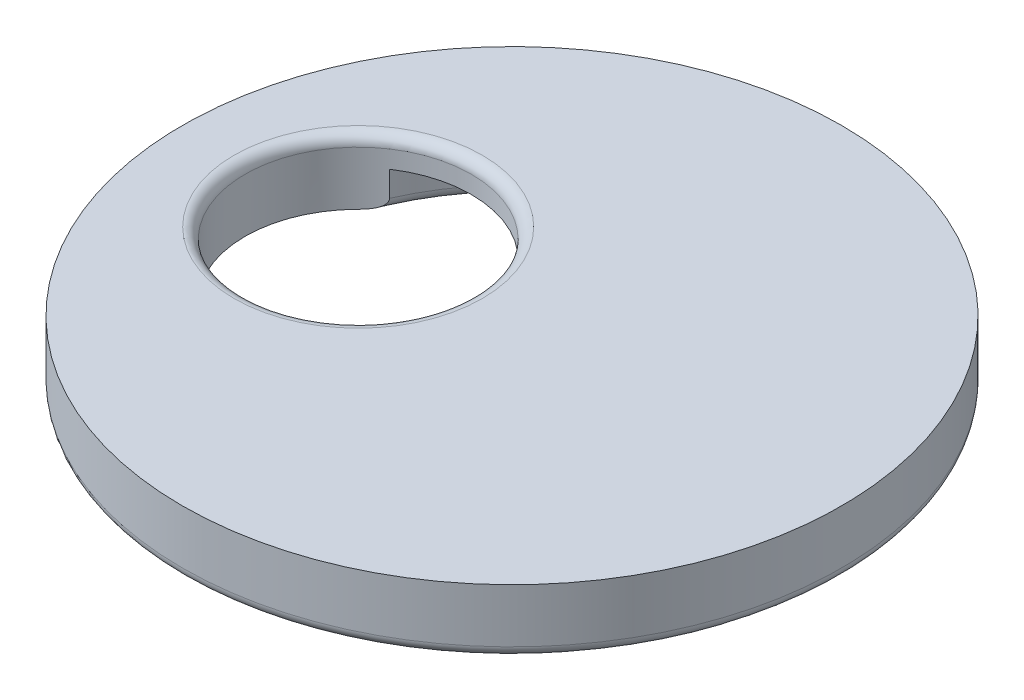
from build123d import *

# Parameters (mm, degrees)
SKETCH1_R           = 15
SKETCH1_R_2         = 5.15
BOSS_EXTRUDE1_DEPTH = 1.3
BOSS_EXTRUDE2_START = -1.65
SKETCH1_3_R         = 15
SKETCH1_3_R_2       = 10.75
BOSS_EXTRUDE2_DEPTH = 1.65
CUT_EXTRUDE1_START  = -1.65
CUT_EXTRUDE1_DEPTH  = 1.65
FILLET5_R           = 0.5
FILLET6_R           = 0.5


with BuildPart() as part:
    # Sketch1 → Boss-Extrude1 (new body)
    with BuildSketch(Plane(origin=(0, 0, 0), x_dir=(1, 0, 0), z_dir=(0, 1, 0))):
        Circle(SKETCH1_R)
        with Locations((-7, 0)):
            Circle(SKETCH1_R_2, mode=Mode.SUBTRACT)
    extrude(amount=BOSS_EXTRUDE1_DEPTH)

    # Sketch1<3> → Boss-Extrude2 (add)
    with BuildSketch(Plane(origin=(0, 0, 0), x_dir=(1, 0, 0), z_dir=(0, 1, 0)).offset(BOSS_EXTRUDE2_START)):
        Circle(SKETCH1_3_R)
        Circle(SKETCH1_3_R_2, mode=Mode.SUBTRACT)
    extrude(amount=BOSS_EXTRUDE2_DEPTH)

    # Sketch1<4> → Cut-Extrude1 (cut)
    with BuildSketch(Plane(origin=(0, 0, 0), x_dir=(1, 0, 0), z_dir=(0, 1, 0)).offset(CUT_EXTRUDE1_START)):
        with BuildLine():
            ThreePointArc((-9.86, -4.282861193), (-10.75, 0), (-9.86, 4.282861193))
            ThreePointArc((-9.86, 4.282861193), (-12.15, 0), (-9.86, -4.282861193))
        make_face()
    extrude(amount=CUT_EXTRUDE1_DEPTH, mode=Mode.SUBTRACT)

    # Fillet5
    fillet5_edges = [part.edges().sort_by_distance(p)[0] for p in [
        (-12.15, 1.3, 0),
    ]]
    fillet(fillet5_edges, radius=FILLET5_R)

    # Fillet6
    fillet6_edges = [part.edges().sort_by_distance(p)[0] for p in [
        (10.75, -1.65, 0),
        (-15, -1.65, 0),
    ]]
    fillet(fillet6_edges, radius=FILLET6_R)


solid = part.part
